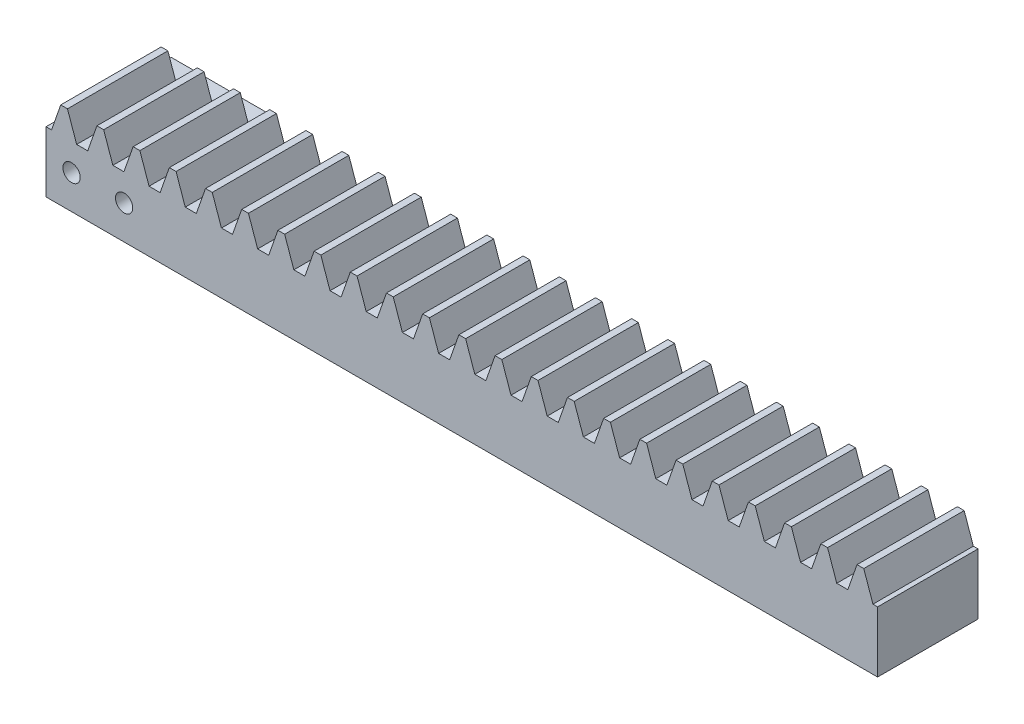
from build123d import *

# Parameters (mm, degrees)
CROQUIS1_W              = 199.517
CROQUIS1_H              = 15.875
SALIENTE_EXTRUIR1_DEPTH = 18.445999938
CORTAR_EXTRUIR3_DEPTH   = 102.759604668
MATRIZL1_COUNT          = 32
MATRIZL1_PITCH          = 6.649704506
CROQUIS5_W              = 19.05
CROQUIS5_H              = 8.992
SALIENTE_EXTRUIR2_DEPTH = 23.00199997
CROQUIS6_R              = 1.5875
CORTAR_EXTRUIR4_DEPTH   = 103.683271428
ESCALA1_SCALE           = 0.25
CROQUIS7_R              = 4.213965504
CORTAR_EXTRUIR5_DEPTH   = 11.684
CROQUIS8_W              = 38.19525
CROQUIS8_H              = 4.611499984
SALIENTE_EXTRUIR3_DEPTH = 0.03


with BuildPart() as part:
    # Croquis1 → Saliente-Extruir1 (new body)
    with BuildSketch(Plane.XY):
        Rectangle(CROQUIS1_W, CROQUIS1_H)
    extrude(amount=SALIENTE_EXTRUIR1_DEPTH)

    # Croquis4 → Cortar-Extruir3 (cut, through all)
    with BuildSketch(Plane.XY.offset(18.445999938)):
        Polygon((-98.7425, 3.1115), (-100.7745, 3.1115), (-102.4636, 7.9375), (-97.0534, 7.9375), align=None)
    cortar_extruir3 = extrude(amount=-CORTAR_EXTRUIR3_DEPTH, mode=Mode.SUBTRACT)

    # MatrizL1: Cortar-Extruir3 ×32
    with Locations(*[(i * MATRIZL1_PITCH, 0, 0) for i in range(1, MATRIZL1_COUNT)]):
        add(cortar_extruir3, mode=Mode.SUBTRACT)

    # Croquis5 → Saliente-Extruir2 (add)
    with BuildSketch(Plane.XY.offset(18.445999938)):
        with Locations((-90.2335, -1.8415)):
            Rectangle(CROQUIS5_W, CROQUIS5_H)
    extrude(amount=-SALIENTE_EXTRUIR2_DEPTH)

    # Croquis6 → Cortar-Extruir4 (cut, through all)
    with BuildSketch(Plane(origin=(0, 0, -4.556000032), x_dir=(-1, 0, 0), z_dir=(0, 0, -1))):
        with Locations((85.4075, -1.8415)):
            Circle(CROQUIS6_R)
        with Locations(Location((95.0595, -1.8415, 0), (0, 0, 180))):
            Circle(CROQUIS6_R)
    extrude(amount=-CORTAR_EXTRUIR4_DEPTH, mode=Mode.SUBTRACT)


with BuildPart() as part_1:
    # Escala1: scaled about (-0.770061652, -1.212816099, 9.056417428)
    add(part.part.scale(ESCALA1_SCALE).moved(Location((-0.577546239, -0.909612074, 6.792313071))))

    # Croquis7 → Cortar-Extruir5 (cut)
    with BuildSketch(Plane(origin=(24.362078761, 0, 0), x_dir=(0, 0, -1), z_dir=(1, 0, 0))):
        with Locations((-9.112278758, -1.455704097)):
            Circle(CROQUIS7_R)
    extrude(amount=-CORTAR_EXTRUIR5_DEPTH, mode=Mode.SUBTRACT)

    # Croquis8 → Saliente-Extruir3 (add)
    with BuildSketch(Plane.XZ.offset(2.893987074)):
        with Locations((-6.419546239, 9.098063063)):
            Rectangle(CROQUIS8_W, CROQUIS8_H)
    extrude(amount=SALIENTE_EXTRUIR3_DEPTH)


solid = part_1.part
